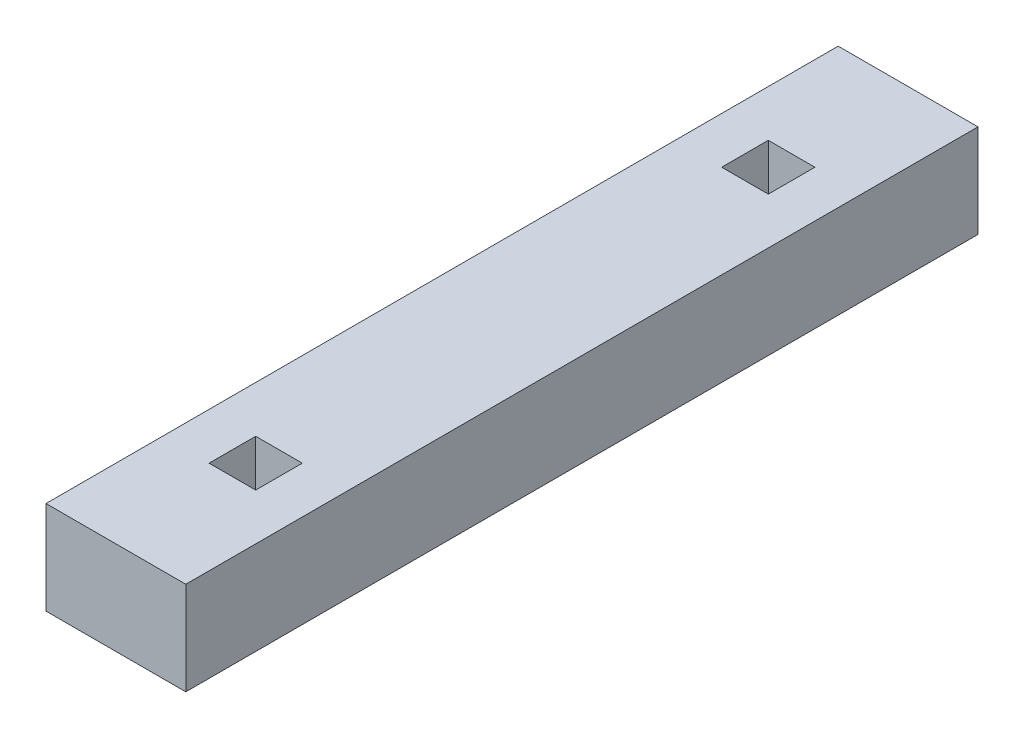
from build123d import *

# Parameters (mm, degrees)
SKETCH1_W           = 30
SKETCH1_H           = 170
SKETCH1_W_2         = 10
SKETCH1_H_2         = 10
BOSS_EXTRUDE1_DEPTH = 20


with BuildPart() as part:
    # Sketch1 → Boss-Extrude1 (new body)
    with BuildSketch(Plane(origin=(0, 0, 0), x_dir=(1, 0, 0), z_dir=(0, 1, 0))):
        with Locations((0, -5)):
            Rectangle(SKETCH1_W, SKETCH1_H)
        with Locations((0, 50)):
            Rectangle(SKETCH1_W_2, SKETCH1_H_2, mode=Mode.SUBTRACT)
        with Locations((0, -60)):
            Rectangle(SKETCH1_W_2, SKETCH1_H_2, mode=Mode.SUBTRACT)
    extrude(amount=BOSS_EXTRUDE1_DEPTH)


solid = part.part
